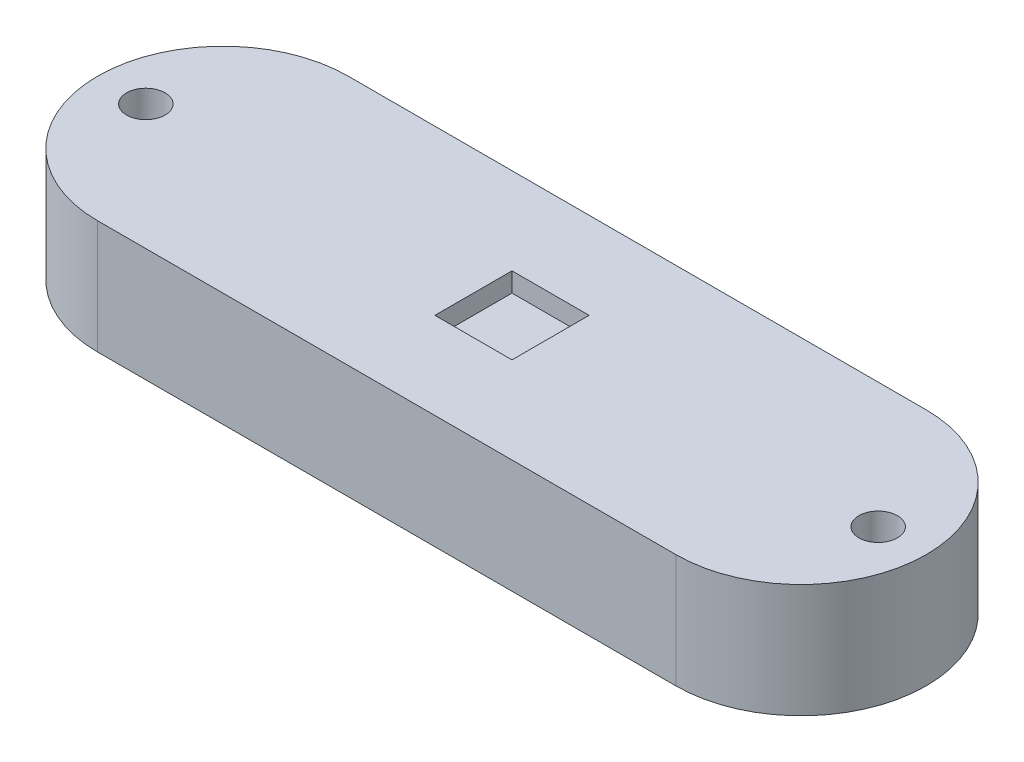
from build123d import *

# Parameters (mm, degrees)
BOSS_EXTRUDE1_DEPTH = 5.9
SKETCH2_R           = 1
CUT_EXTRUDE1_DEPTH  = 5.9
SKETCH3_W           = 4
SKETCH3_H           = 4
CUT_EXTRUDE2_DEPTH  = 1
SKETCH4_W           = 8
SKETCH4_H           = 5
BOSS_EXTRUDE2_DEPTH = 1.95


with BuildPart() as part:
    # Sketch1 → Boss-Extrude1 (new body)
    with BuildSketch(Plane(origin=(0, 0, 0), x_dir=(1, 0, 0), z_dir=(0, 1, 0))):
        with BuildLine():
            Line((-15, 6.5), (15, 6.5))
            ThreePointArc((15, 6.5), (21.5, 0), (15, -6.5))
            Line((15, -6.5), (-15, -6.5))
            ThreePointArc((-15, -6.5), (-21.5, 0), (-15, 6.5))
        make_face()
    extrude(amount=BOSS_EXTRUDE1_DEPTH)

    # Sketch2 → Cut-Extrude1 (cut)
    with BuildSketch(Plane(origin=(0, 5.9, 0), x_dir=(1, 0, 0), z_dir=(0, 1, 0))):
        with Locations(Location((-19, 0, 0), (0, 0, 270))):
            Circle(SKETCH2_R)
        with Locations(Location((19, 0, 0), (0, 0, 270))):
            Circle(SKETCH2_R)
    extrude(amount=-CUT_EXTRUDE1_DEPTH, mode=Mode.SUBTRACT)

    # Sketch3 → Cut-Extrude2 (cut)
    with BuildSketch(Plane(origin=(0, 5.9, 0), x_dir=(1, 0, 0), z_dir=(0, 1, 0))):
        Rectangle(SKETCH3_W, SKETCH3_H)
    extrude(amount=-CUT_EXTRUDE2_DEPTH, mode=Mode.SUBTRACT)

    # Sketch4 → Boss-Extrude2 (add)
    with BuildSketch(Plane.XZ):
        with Locations((9.93462309, 0.219446149)):
            Rectangle(SKETCH4_W, SKETCH4_H)
    extrude(amount=BOSS_EXTRUDE2_DEPTH)


solid = part.part
